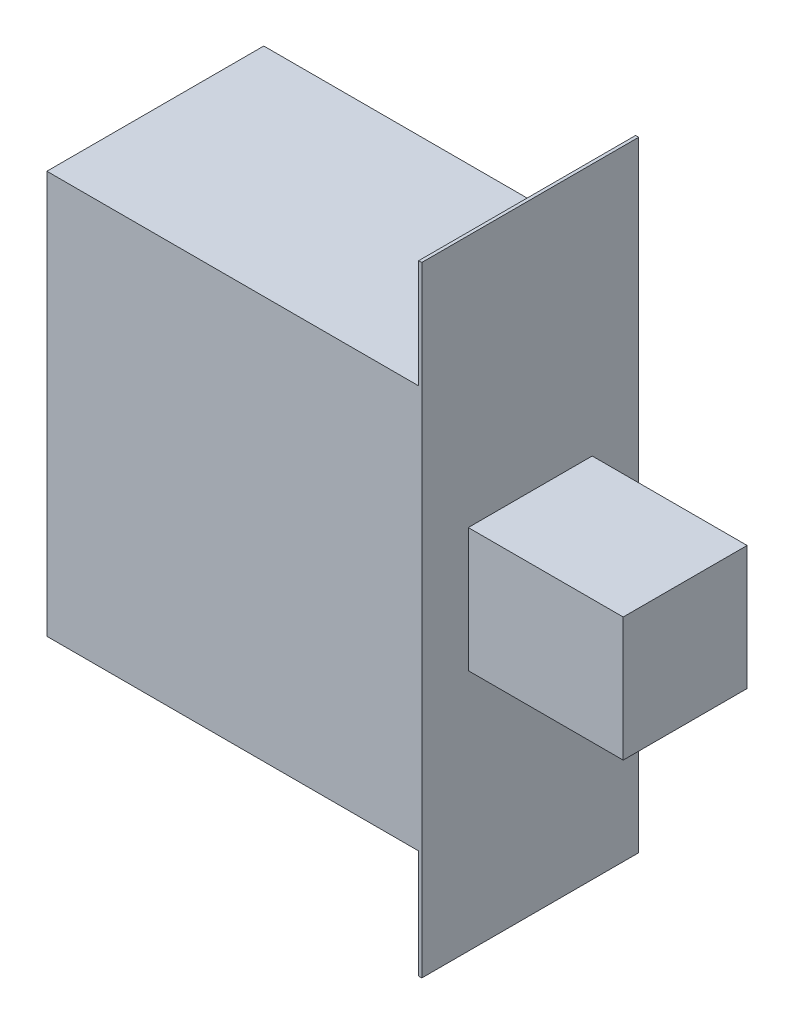
from build123d import *

# Parameters (mm, degrees)
SKETCH1_W           = 12
SKETCH1_H           = 13
BOSS_EXTRUDE1_DEPTH = 7
SKETCH3_W           = 7
SKETCH3_H           = 20
BOSS_EXTRUDE2_DEPTH = 0.1
SKETCH4_W           = 4
SKETCH4_H           = 4
BOSS_EXTRUDE3_DEPTH = 5


with BuildPart() as part:
    # Sketch1 → Boss-Extrude1 (new body)
    with BuildSketch(Plane.XY):
        with Locations((6, 6.5)):
            Rectangle(SKETCH1_W, SKETCH1_H)
    extrude(amount=BOSS_EXTRUDE1_DEPTH)

    # Sketch3 → Boss-Extrude2 (add)
    with BuildSketch(Plane(origin=(12, 0, 0), x_dir=(0, 0, -1), z_dir=(1, 0, 0))):
        with Locations((-3.5, 6.5)):
            Rectangle(SKETCH3_W, SKETCH3_H)
    extrude(amount=BOSS_EXTRUDE2_DEPTH)

    # Sketch4 → Boss-Extrude3 (add)
    with BuildSketch(Plane(origin=(12.1, 0, 0), x_dir=(0, 0, -1), z_dir=(1, 0, 0))):
        with Locations((-3.5, 6.340282973)):
            Rectangle(SKETCH4_W, SKETCH4_H)
    extrude(amount=BOSS_EXTRUDE3_DEPTH)


solid = part.part
